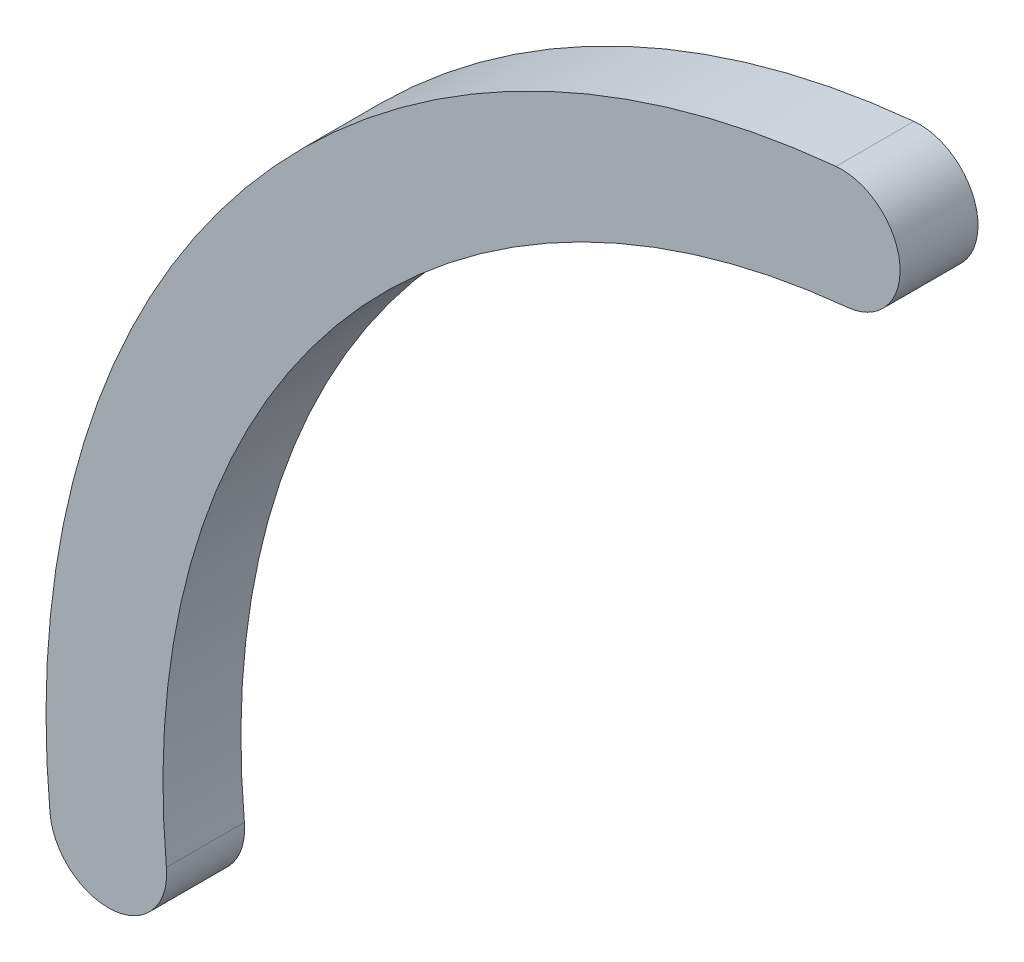
from build123d import *

# Parameters (mm, degrees)
BOSS_EXTRUDE1_DEPTH = 2.54


with BuildPart() as part:
    # Sketch2 → Boss-Extrude1 (new body)
    with BuildSketch(Plane.XY.offset(-8.360261082)):
        with BuildLine():
            ThreePointArc((-46.972645597, 79.261825447), (-44.894174994, 77.547763034), (-46.608237407, 75.469292432))
            ThreePointArc((-46.608237407, 75.469292432), (-63.269151824, 66.614832594), (-68.789148794, 48.572738434))
            ThreePointArc((-68.789148794, 48.572738434), (-70.503211207, 46.494267832), (-72.58168181, 48.208330245))
            ThreePointArc((-72.58168181, 48.208330245), (-66.208553139, 69.038882905), (-46.972645597, 79.261825447))
        make_face()
    extrude(amount=BOSS_EXTRUDE1_DEPTH)


solid = part.part
